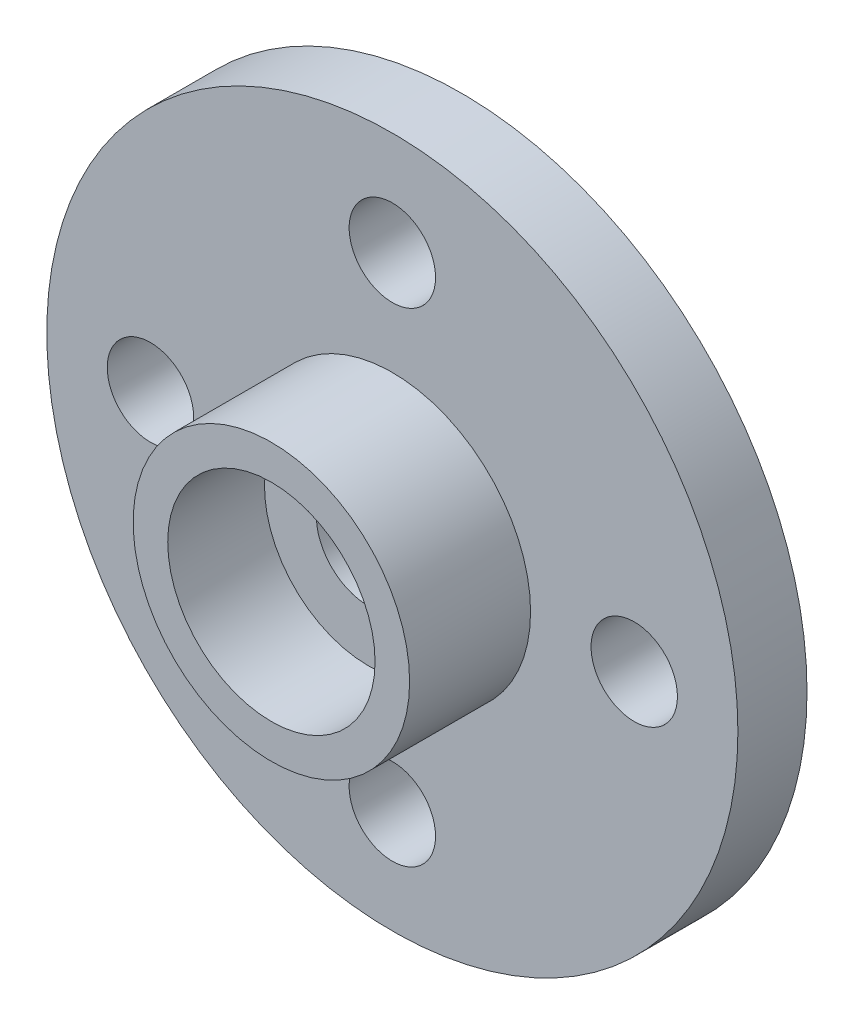
from build123d import *

# Parameters (mm, degrees)
SKETCH_1_R         = 10
SKETCH_1_R_2       = 3
EXTRUDE_1_DEPTH    = 2
SKETCH_2_R         = 4
SKETCH_2_R_2       = 3
EXTRUDE_1_2_DEPTH  = 3.5
HOLE_WIZARD_M3_1_D = 2.5
SKETCH_6_W         = 1.3
SKETCH_6_H         = 1.5
EXTRUDE_START      = 1.4
SKETCH_7_R         = 3
EXTRUDE_2_DEPTH    = 1.4


with BuildPart() as part:
    # 草图1 → Extrude 1 (new body)
    with BuildSketch(Plane.XY):
        Circle(SKETCH_1_R)
        Circle(SKETCH_1_R_2, mode=Mode.SUBTRACT)
    extrude(amount=EXTRUDE_1_DEPTH)

    # 草图2 → Extrude 1 2 (add)
    with BuildSketch(Plane.XY.offset(2)):
        Circle(SKETCH_2_R)
        Circle(SKETCH_2_R_2, mode=Mode.SUBTRACT)
    extrude(amount=EXTRUDE_1_2_DEPTH)

    # M3 螺纹孔1 (through all)
    with Locations(Plane(origin=(-7, 0, 2), x_dir=(1, 0, 0), z_dir=(0, 0, 1))):
        with Locations((0, 0), (7, 7), (14, 0), (7, -7)):
            Hole(HOLE_WIZARD_M3_1_D / 2)

    # 草图6 → 旋转1 (revolve)
    with BuildSketch(Plane(origin=(0, 0, 0), x_dir=(0, 0, -1), z_dir=(1, 0, 0))):
        with Locations((-2.05, 2.25)):
            Rectangle(SKETCH_6_W, SKETCH_6_H)
    revolve(axis=Axis((0, 0, 0), (0, 0, 1)))

    # 草图7 → 凸台-拉伸2 (add)
    with BuildSketch(Plane(origin=(0, 0, 1.4), x_dir=(-1, 0, 0), z_dir=(0, 0, -1)).offset(EXTRUDE_START)):
        with Locations(Location((0, 0, 0), (0, 0, 270))):
            Circle(SKETCH_7_R)
    extrude(amount=-EXTRUDE_2_DEPTH)


solid = part.part
